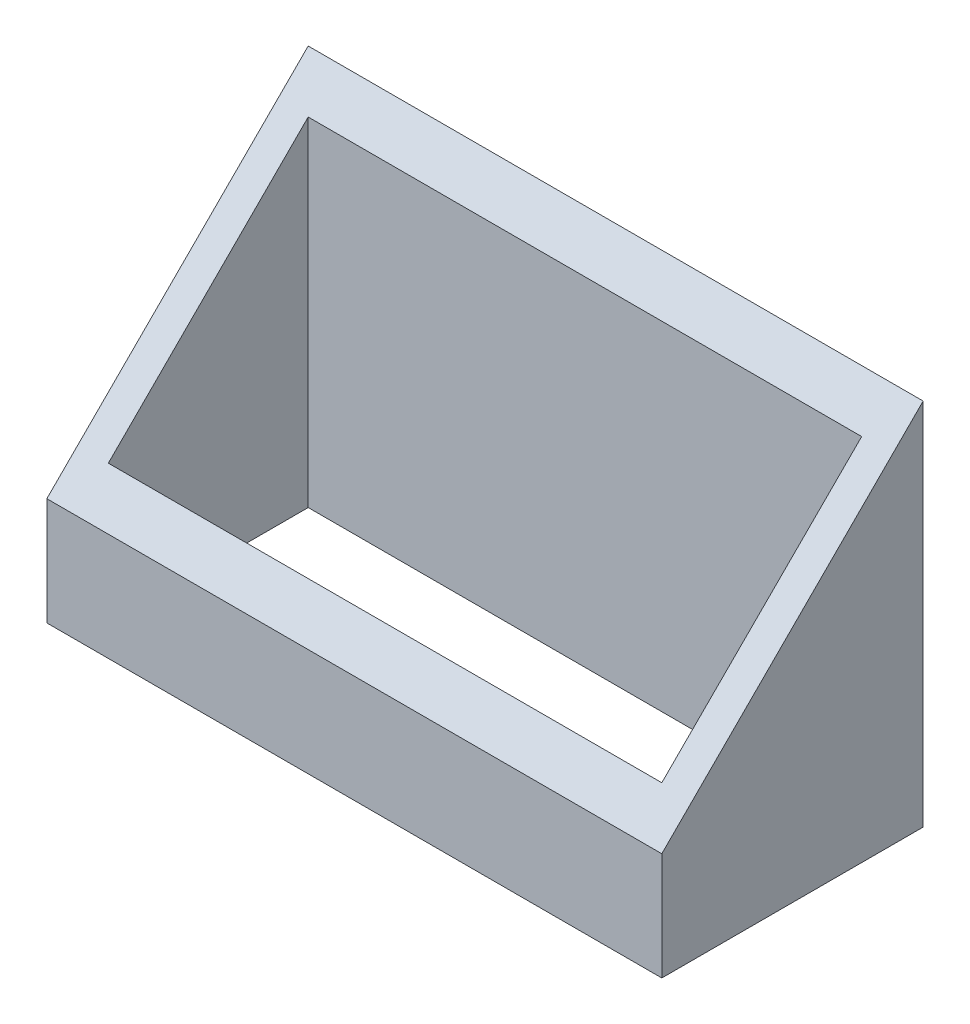
from build123d import *

# Parameters (mm, degrees)
BOSS_EXTRUDE2_DEPTH = 100
SKETCH3_W           = 90
SKETCH3_H           = 32.5
CUT_EXTRUDE1_DEPTH  = 60


with BuildPart() as part:
    # Sketch2 → Boss-Extrude2 (new body)
    with BuildSketch(Plane(origin=(0, 0, 0), x_dir=(0, 0, -1), z_dir=(1, 0, 0))):
        Polygon((42.5, 60), (0, 17.5), (0, 0), (42.5, 0), align=None)
    extrude(amount=BOSS_EXTRUDE2_DEPTH)

    # Sketch3 → Cut-Extrude1 (cut)
    with BuildSketch(Plane.XZ):
        with Locations((50, -21.25)):
            Rectangle(SKETCH3_W, SKETCH3_H)
    extrude(amount=-CUT_EXTRUDE1_DEPTH, mode=Mode.SUBTRACT)


solid = part.part
